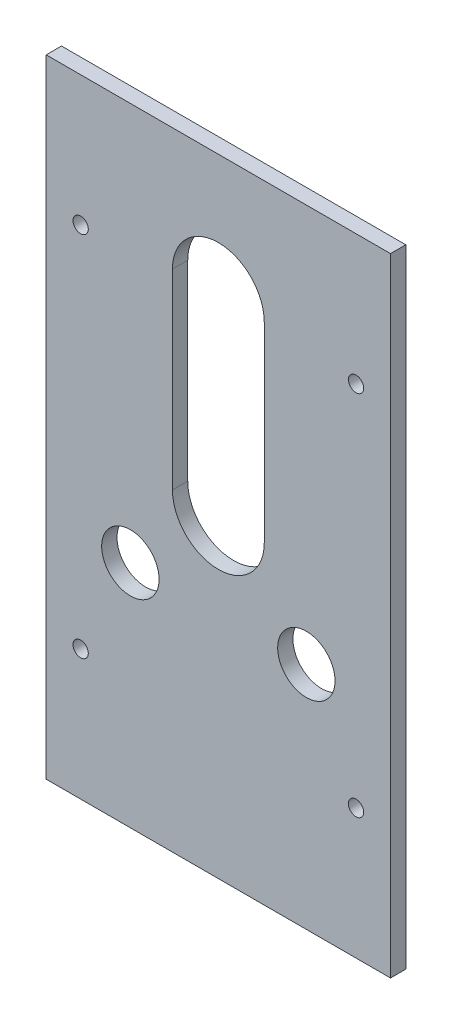
from build123d import *

# Parameters (mm, degrees)
SKETCH_1_W      = 90
SKETCH_1_H      = 164
SKETCH_1_R      = 2
SKETCH_1_R_2    = 7.5
EXTRUDE_1_DEPTH = 4


with BuildPart() as part:
    # 草图1 → 凸台-拉伸1 (new body)
    with BuildSketch(Plane.XY):
        Rectangle(SKETCH_1_W, SKETCH_1_H)
        with Locations((-36, 48)):
            Circle(SKETCH_1_R, mode=Mode.SUBTRACT)
        with Locations((-36, -48)):
            Circle(SKETCH_1_R, mode=Mode.SUBTRACT)
        with Locations(Location((36, -48, 0), (0, 0, 180))):
            Circle(SKETCH_1_R, mode=Mode.SUBTRACT)
        with Locations(Location((36, 48, 0), (0, 0, 180))):
            Circle(SKETCH_1_R, mode=Mode.SUBTRACT)
        with Locations((-23, -22)):
            Circle(SKETCH_1_R_2, mode=Mode.SUBTRACT)
        with Locations(Location((23, -22, 0), (0, 0, 180))):
            Circle(SKETCH_1_R_2, mode=Mode.SUBTRACT)
        with BuildLine():
            Line((-12, 0), (-12, 50))
            ThreePointArc((-12, 50), (0, 62), (12, 50))
            Line((12, 50), (12, 0))
            ThreePointArc((12, 0), (0, -12), (-12, 0))
        make_face(mode=Mode.SUBTRACT)
    extrude(amount=EXTRUDE_1_DEPTH)


solid = part.part
